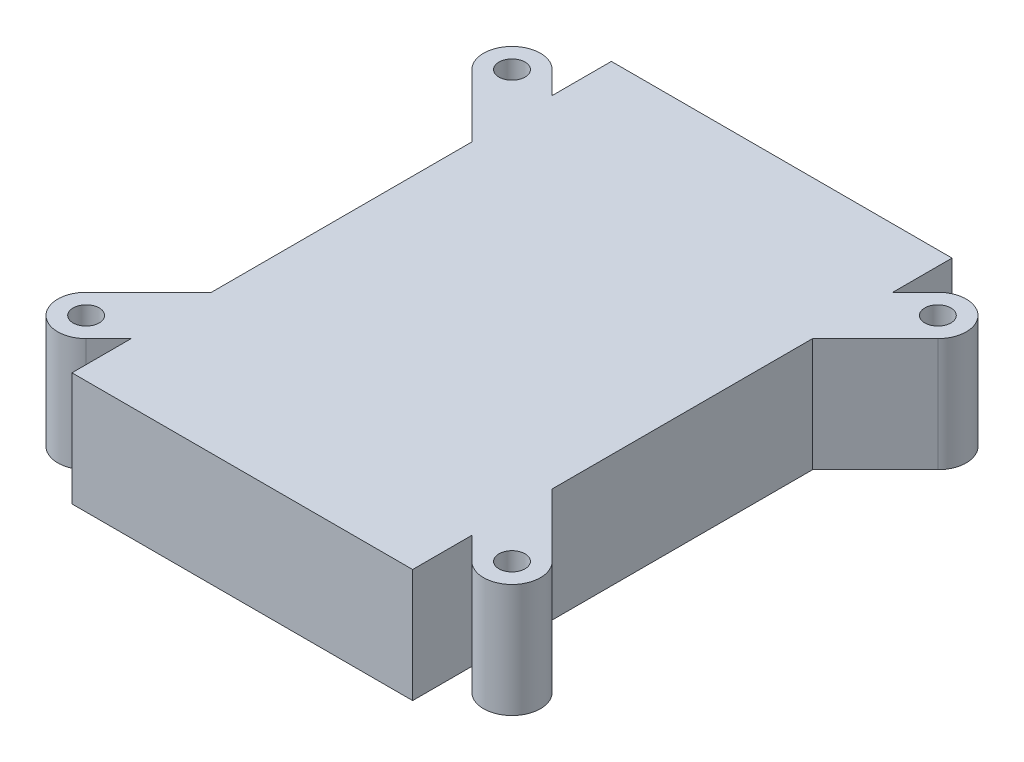
from build123d import *

# Parameters (mm, degrees)
BOSS_EXTRU_1_DEPTH = 20


with BuildPart() as part:
    # Esquisse1 → Boss.-Extru.1 (new body)
    with BuildSketch(Plane(origin=(0, 0, 0), x_dir=(1, 0, 0), z_dir=(0, 1, 0))):
        Polygon((30, -47.5), (30, 47.5), (0, 47.5), (-30, 47.5), (-30, -47.5), align=None)
        with BuildLine():
            Line((-30, -37.071067812), (-30, -22.928932188))
            Line((-30, -22.928932188), (-41.035533906, -33.964466094))
            ThreePointArc((-41.035533906, -33.964466094), (-35.586582838, -32.880602337), (-32.5, -37.5))
            ThreePointArc((-32.5, -37.5), (-32.880602337, -39.413417162), (-33.964466094, -41.035533906))
            Line((-33.964466094, -41.035533906), (-30, -37.071067812))
        make_face()
        with BuildLine():
            ThreePointArc((-32.5, -37.5), (-35.586582838, -32.880602337), (-41.035533906, -33.964466094))
            Line((-41.035533906, -33.964466094), (-39.126345597, -35.873654403))
            ThreePointArc((-39.126345597, -35.873654403), (-36.619828106, -35.375077075), (-35.2, -37.5))
            ThreePointArc((-35.2, -37.5), (-35.375077075, -38.380171894), (-35.873654403, -39.126345597))
            Line((-35.873654403, -39.126345597), (-33.964466094, -41.035533906))
            ThreePointArc((-33.964466094, -41.035533906), (-32.880602337, -39.413417162), (-32.5, -37.5))
        make_face()
        with BuildLine():
            Line((-39.126345597, -35.873654403), (-41.035533906, -33.964466094))
            ThreePointArc((-41.035533906, -33.964466094), (-41.035533906, -41.035533906), (-33.964466094, -41.035533906))
            Line((-33.964466094, -41.035533906), (-35.873654403, -39.126345597))
            ThreePointArc((-35.873654403, -39.126345597), (-39.126345597, -39.126345597), (-39.126345597, -35.873654403))
        make_face()
        with BuildLine():
            ThreePointArc((42.5, -37.5), (42.119397663, -35.586582838), (41.035533906, -33.964466094))
            Line((41.035533906, -33.964466094), (39.126345597, -35.873654403))
            ThreePointArc((39.126345597, -35.873654403), (39.624922925, -36.619828106), (39.8, -37.5))
            ThreePointArc((39.8, -37.5), (38.380171894, -39.624922925), (35.873654403, -39.126345597))
            Line((35.873654403, -39.126345597), (33.964466094, -41.035533906))
            ThreePointArc((33.964466094, -41.035533906), (39.413417162, -42.119397663), (42.5, -37.5))
        make_face()
        with BuildLine():
            Line((39.126345597, -35.873654403), (41.035533906, -33.964466094))
            ThreePointArc((41.035533906, -33.964466094), (33.964466094, -33.964466094), (33.964466094, -41.035533906))
            Line((33.964466094, -41.035533906), (35.873654403, -39.126345597))
            ThreePointArc((35.873654403, -39.126345597), (35.873654403, -35.873654403), (39.126345597, -35.873654403))
        make_face()
        with BuildLine():
            Line((41.035533906, -33.964466094), (30, -22.928932188))
            Line((30, -22.928932188), (30, -37.071067812))
            Line((30, -37.071067812), (33.964466094, -41.035533906))
            ThreePointArc((33.964466094, -41.035533906), (33.964466094, -33.964466094), (41.035533906, -33.964466094))
        make_face()
        with BuildLine():
            Line((33.964466094, 41.035533906), (30, 37.071067812))
            Line((30, 37.071067812), (30, 22.928932188))
            Line((30, 22.928932188), (41.035533906, 33.964466094))
            ThreePointArc((41.035533906, 33.964466094), (33.964466094, 33.964466094), (33.964466094, 41.035533906))
        make_face()
        with BuildLine():
            ThreePointArc((42.5, 37.5), (39.413417162, 42.119397663), (33.964466094, 41.035533906))
            Line((33.964466094, 41.035533906), (35.873654403, 39.126345597))
            ThreePointArc((35.873654403, 39.126345597), (38.380171894, 39.624922925), (39.8, 37.5))
            ThreePointArc((39.8, 37.5), (39.624922925, 36.619828106), (39.126345597, 35.873654403))
            Line((39.126345597, 35.873654403), (41.035533906, 33.964466094))
            ThreePointArc((41.035533906, 33.964466094), (42.119397663, 35.586582838), (42.5, 37.5))
        make_face()
        with BuildLine():
            Line((35.873654403, 39.126345597), (33.964466094, 41.035533906))
            ThreePointArc((33.964466094, 41.035533906), (33.964466094, 33.964466094), (41.035533906, 33.964466094))
            Line((41.035533906, 33.964466094), (39.126345597, 35.873654403))
            ThreePointArc((39.126345597, 35.873654403), (35.873654403, 35.873654403), (35.873654403, 39.126345597))
        make_face()
        with BuildLine():
            Line((-30, 22.928932188), (-30, 37.071067812))
            Line((-30, 37.071067812), (-33.964466094, 41.035533906))
            ThreePointArc((-33.964466094, 41.035533906), (-32.880602337, 39.413417162), (-32.5, 37.5))
            ThreePointArc((-32.5, 37.5), (-35.586582838, 32.880602337), (-41.035533906, 33.964466094))
            Line((-41.035533906, 33.964466094), (-30, 22.928932188))
        make_face()
        with BuildLine():
            ThreePointArc((-32.5, 37.5), (-32.880602337, 39.413417162), (-33.964466094, 41.035533906))
            Line((-33.964466094, 41.035533906), (-35.873654403, 39.126345597))
            ThreePointArc((-35.873654403, 39.126345597), (-35.375077075, 38.380171894), (-35.2, 37.5))
            ThreePointArc((-35.2, 37.5), (-36.619828106, 35.375077075), (-39.126345597, 35.873654403))
            Line((-39.126345597, 35.873654403), (-41.035533906, 33.964466094))
            ThreePointArc((-41.035533906, 33.964466094), (-35.586582838, 32.880602337), (-32.5, 37.5))
        make_face()
        with BuildLine():
            Line((-35.873654403, 39.126345597), (-33.964466094, 41.035533906))
            ThreePointArc((-33.964466094, 41.035533906), (-41.035533906, 41.035533906), (-41.035533906, 33.964466094))
            Line((-41.035533906, 33.964466094), (-39.126345597, 35.873654403))
            ThreePointArc((-39.126345597, 35.873654403), (-39.126345597, 39.126345597), (-35.873654403, 39.126345597))
        make_face()
    extrude(amount=BOSS_EXTRU_1_DEPTH)


solid = part.part
